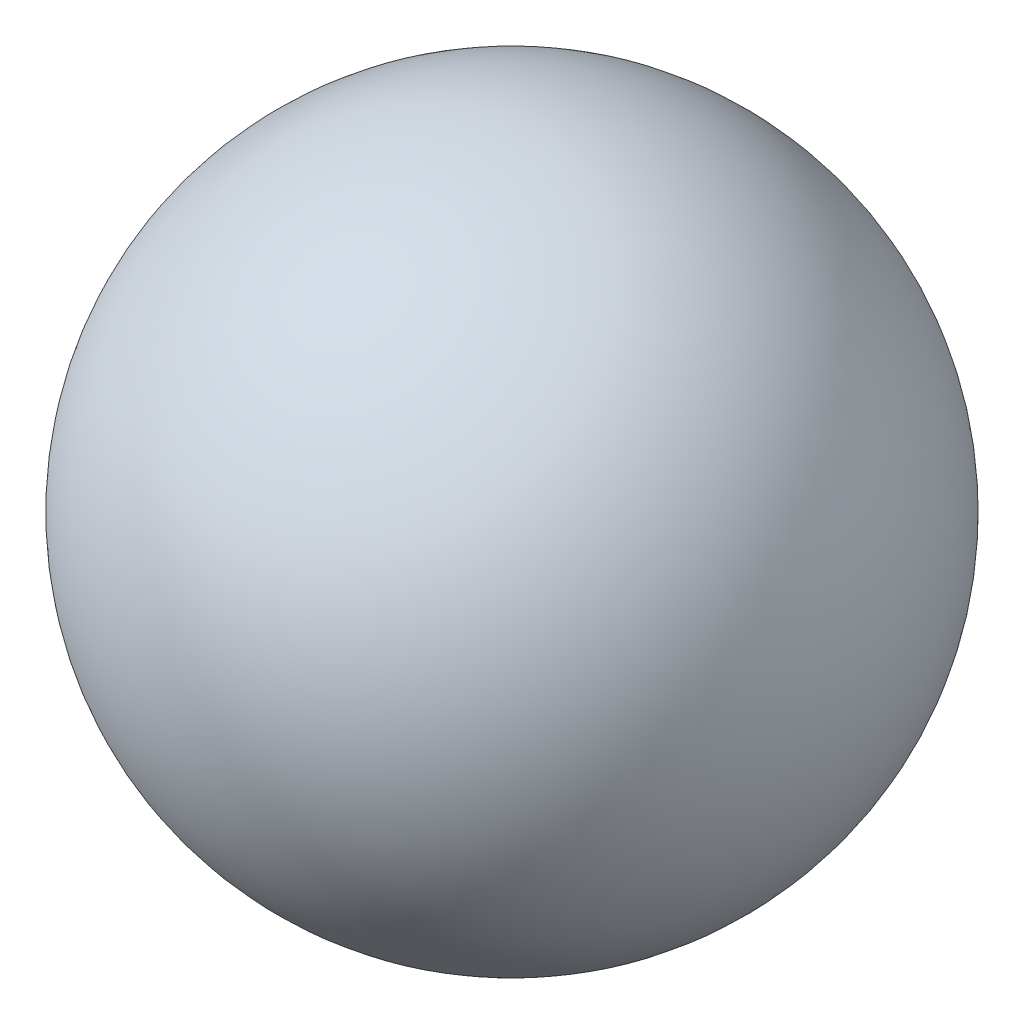
from build123d import *


with BuildPart() as part:
    # Sketch4 → Revolve2 (revolve)
    with BuildSketch(Plane(origin=(0, 0, 0), x_dir=(0, 0, -1), z_dir=(1, 0, 0))):
        with BuildLine():
            Line((0, 13.943679092), (0, -13.943679092))
            ThreePointArc((0, -13.943679092), (13.943679092, 0), (0, 13.943679092))
        make_face()
    revolve(axis=Axis((0, 13.943679092, 0), (0, -1, 0)))


solid = part.part
